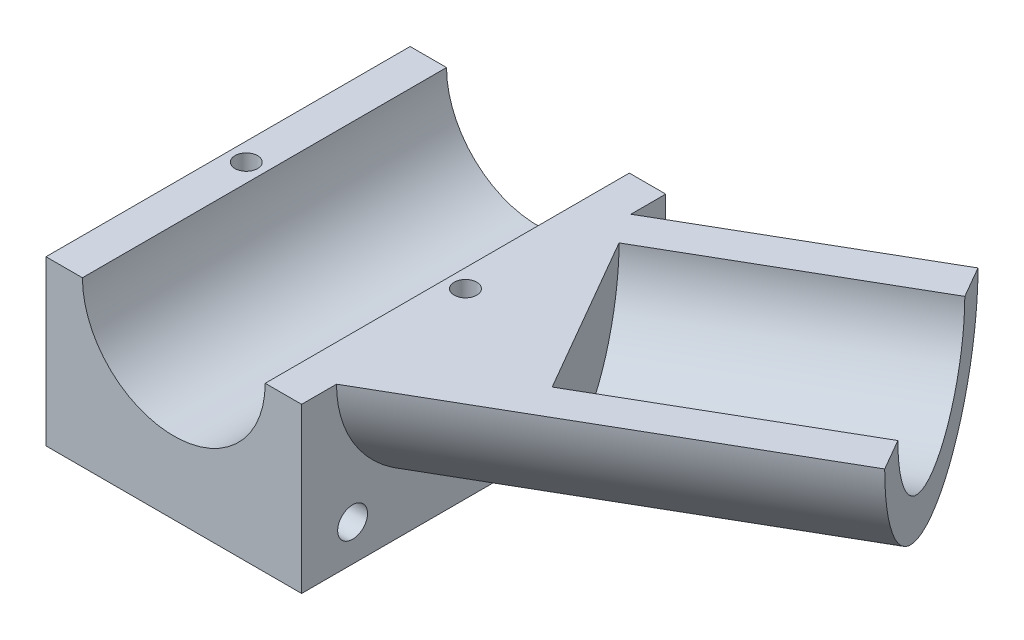
from build123d import *

# Parameters (mm, degrees)
BOSS_EXTRUDE1_DEPTH             = 25
SKETCH2_R                       = 1.55
CUT_EXTRUDE1_DEPTH              = 22.5
BOSS_EXTRUDE2_REACH             = 65.436
BOSS_EXTRUDE2_DIRECTION_2_DEPTH = 30
CUT_EXTRUDE2_REACH              = 80.642
CUT_EXTRUDE2_END_RADIUS         = 17.5
SKETCH7_R                       = 1.55
SKETCH9_R                       = 2.05
CUT_EXTRUDE3_DEPTH              = 35.1
BOSS_EXTRUDE5_REACH             = 63.632


with BuildPart() as part:
    # Sketch1 → Boss-Extrude1 (new, symmetric)
    with BuildSketch(Plane.XY):
        with BuildLine():
            Line((-17.55, 22.5), (-17.55, 0))
            Line((-17.55, 0), (17.55, 0))
            Line((17.55, 0), (17.55, 22.5))
            Line((17.55, 22.5), (12.55, 22.5))
            ThreePointArc((12.55, 22.5), (0, 9.95), (-12.55, 22.5))
            Line((-12.55, 22.5), (-17.55, 22.5))
        make_face()
    extrude(amount=BOSS_EXTRUDE1_DEPTH, both=True)

    # Sketch2 → Cut-Extrude1 (cut)
    with BuildSketch(Plane(origin=(0, 22.5, 0), x_dir=(1, 0, 0), z_dir=(0, 1, 0))):
        with Locations(Location((-15.05, 0, 0), (0, 0, 270))):
            Circle(SKETCH2_R)
        with Locations(Location((15.05, 0, 0), (0, 0, 270))):
            Circle(SKETCH2_R)
    extrude(amount=-CUT_EXTRUDE1_DEPTH, mode=Mode.SUBTRACT)

    # Boss-Extrude2: up to this plane
    boss_extrude2_end = Plane(origin=(17.55, 0, 25), z_dir=(-1, 0, 0))
    # Sketch5 → Boss-Extrude2 (add, up to the surface)
    with BuildSketch(Plane(origin=(26.152881057, 0, -15.099372918), x_dir=(-0.5000000000000013, 0, -0.8660254037844379), z_dir=(0.8660254037844379, 0, -0.5000000000000013)), mode=Mode.PRIVATE) as boss_extrude2_sk1:
        with BuildLine():
            Line((-26.275, 22.5), (-21.325, 22.5))
            ThreePointArc((-21.325, 22.5), (-8.775, 9.95), (3.775, 22.5))
            Line((3.775, 22.5), (8.725, 22.5))
            ThreePointArc((8.725, 22.5), (-8.775, 5), (-26.275, 22.5))
        make_face()
    boss_extrude2_tool1 = split(extrude(boss_extrude2_sk1.sketch, amount=-BOSS_EXTRUDE2_REACH, mode=Mode.PRIVATE), bisect_by=boss_extrude2_end, keep=Keep.BOTH, mode=Mode.PRIVATE)
    add(boss_extrude2_tool1.solids().sort_by_distance((38.052881, 22.108688, 5.512032))[0])

    # Sketch5 → Boss-Extrude2 direction 2 (add)
    with BuildSketch(Plane(origin=(26.152881057, 0, -15.099372918), x_dir=(-0.5000000000000013, 0, -0.8660254037844379), z_dir=(0.8660254037844379, 0, -0.5000000000000013))):
        with BuildLine():
            Line((-26.275, 22.5), (-21.325, 22.5))
            ThreePointArc((-21.325, 22.5), (-8.775, 9.95), (3.775, 22.5))
            Line((3.775, 22.5), (8.725, 22.5))
            ThreePointArc((8.725, 22.5), (-8.775, 5), (-26.275, 22.5))
        make_face()
    extrude(amount=BOSS_EXTRUDE2_DIRECTION_2_DEPTH)

    # Cut-Extrude2: up to this cylinder (the profile starts inside it)
    cut_extrude2_end = Plane(origin=(43.530762028, 22.5, -14.999999951), z_dir=(-0.8660254037844379, 0, 0.5000000000000013)) * Cylinder(CUT_EXTRUDE2_END_RADIUS, 197.284, mode=Mode.PRIVATE)
    # Sketch7 → Cut-Extrude2 (cut, up to the surface)
    with BuildSketch(Plane(origin=(0, 22.5, 0), x_dir=(1, 0, 0), z_dir=(0, 1, 0)), mode=Mode.PRIVATE) as cut_extrude2_sk1:
        with Locations(Location((43.530762114, 15, 0), (0, 0, 180))):
            Circle(SKETCH7_R)
    cut_extrude2_tool1 = extrude(cut_extrude2_sk1.sketch, amount=-CUT_EXTRUDE2_REACH, mode=Mode.PRIVATE) & cut_extrude2_end
    add(cut_extrude2_tool1.solids().sort_by_distance((43.530762, 22.5, -15))[0], mode=Mode.SUBTRACT)

    # Sketch9 → Cut-Extrude3 (cut)
    with BuildSketch(Plane.ZY.offset(17.55)):
        with Locations((-18, 5)):
            Circle(SKETCH9_R)
        with Locations((18, 5)):
            Circle(SKETCH9_R)
    extrude(amount=-CUT_EXTRUDE3_DEPTH, mode=Mode.SUBTRACT)

    # Boss-Extrude5: up to this face of the body (flat: up to its plane)
    boss_extrude5_end = Plane(part.part.faces().sort_by_distance((17.55, 17.173614571, 0))[0])
    # Sketch12 → Boss-Extrude5 (add, up to the picked face)
    with BuildSketch(Plane(origin=(22.035576211, 0, -12.722245857), x_dir=(-0.4999999999999781, 0, -0.8660254037844513), z_dir=(0.8660254037844513, 0, -0.4999999999999781)), mode=Mode.PRIVATE) as boss_extrude5_sk1:
        with BuildLine():
            Line((-21.325, 22.5), (3.775, 22.5))
            ThreePointArc((3.775, 22.5), (-8.775, 9.95), (-21.325, 22.5))
        make_face()
    boss_extrude5_tool1 = split(extrude(boss_extrude5_sk1.sketch, amount=-BOSS_EXTRUDE5_REACH, mode=Mode.PRIVATE), bisect_by=boss_extrude5_end, keep=Keep.BOTH, mode=Mode.PRIVATE)
    add(boss_extrude5_tool1.solids().sort_by(Axis((26.423076, 17.173615, -5.122873), (-0.8660254037844513, 0, 0.4999999999999781)))[0])


solid = part.part
